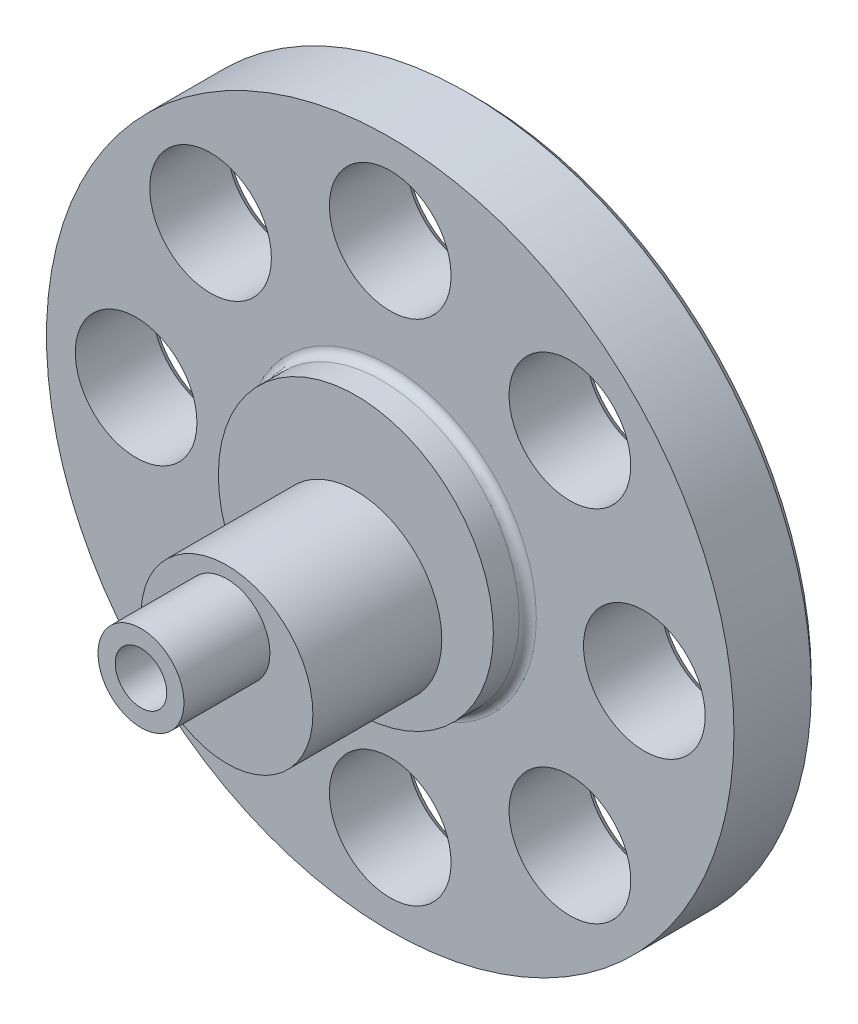
from build123d import *

# Parameters (mm, degrees)
SKETCH1_R           = 20
SKETCH1_R_2         = 3.54
BOSS_EXTRUDE1_DEPTH = 5
SKETCH2_R           = 8
BOSS_EXTRUDE2_DEPTH = 2
SKETCH3_R           = 6.5
CUT_EXTRUDE1_DEPTH  = 6
SKETCH4_R           = 5
BOSS_EXTRUDE3_DEPTH = 7.5
SKETCH5_R           = 2.5
BOSS_EXTRUDE4_DEPTH = 5
FILLET1_R           = 0.5
CHAMFER1_SIZE       = 0.5
SKETCH7_R           = 1.5
CUT_EXTRUDE2_DEPTH  = 15


with BuildPart() as part:
    # Sketch1 → Boss-Extrude1 (new body)
    with BuildSketch(Plane.XY):
        Circle(SKETCH1_R)
        with Locations((-14.783956386, 0)):
            Circle(SKETCH1_R_2, mode=Mode.SUBTRACT)
        with Locations((-10.453835814, -10.453835814)):
            Circle(SKETCH1_R_2, mode=Mode.SUBTRACT)
        with Locations((0, -14.783956386)):
            Circle(SKETCH1_R_2, mode=Mode.SUBTRACT)
        with Locations((10.453835814, -10.453835814)):
            Circle(SKETCH1_R_2, mode=Mode.SUBTRACT)
        with Locations((14.783956386, 0)):
            Circle(SKETCH1_R_2, mode=Mode.SUBTRACT)
        with Locations((10.453835814, 10.453835814)):
            Circle(SKETCH1_R_2, mode=Mode.SUBTRACT)
        with Locations((0, 14.783956386)):
            Circle(SKETCH1_R_2, mode=Mode.SUBTRACT)
        with Locations((-10.453835814, 10.453835814)):
            Circle(SKETCH1_R_2, mode=Mode.SUBTRACT)
    extrude(amount=BOSS_EXTRUDE1_DEPTH)

    # Sketch2 → Boss-Extrude2 (add)
    with BuildSketch(Plane.XY.offset(5)):
        Circle(SKETCH2_R)
    extrude(amount=BOSS_EXTRUDE2_DEPTH)

    # Sketch3 → Cut-Extrude1 (cut)
    with BuildSketch(Plane(origin=(0, 0, 0), x_dir=(-1, 0, 0), z_dir=(0, 0, -1))):
        Circle(SKETCH3_R)
    extrude(amount=-CUT_EXTRUDE1_DEPTH, mode=Mode.SUBTRACT)

    # Sketch4 → Boss-Extrude3 (add)
    with BuildSketch(Plane.XY.offset(7)):
        with Locations((0, -1.812)):
            Circle(SKETCH4_R)
    extrude(amount=BOSS_EXTRUDE3_DEPTH)

    # Sketch5 → Boss-Extrude4 (add)
    with BuildSketch(Plane.XY.offset(14.5)):
        Circle(SKETCH5_R)
    extrude(amount=BOSS_EXTRUDE4_DEPTH)

    # Fillet1
    fillet1_edges = [part.edges().sort_by_distance(p)[0] for p in [
        (-8, 0, 5),
    ]]
    fillet(fillet1_edges, radius=FILLET1_R)

    # Chamfer1
    chamfer1_edges = [part.edges().sort_by_distance(p)[0] for p in [
        (-3.54, -14.783956386, 0),
        (6.913835814, -10.453835814, 0),
        (-20, 0, 0),
        (11.243956386, 0, 0),
        (6.913835814, 10.453835814, 0),
        (-3.54, 14.783956386, 0),
        (-13.993835814, 10.453835814, 0),
        (6.5, 0, 0),
        (-18.323956386, 0, 0),
        (-13.993835814, -10.453835814, 0),
    ]]
    chamfer(chamfer1_edges, length=CHAMFER1_SIZE)

    # Sketch7 → Cut-Extrude2 (cut)
    with BuildSketch(Plane.XY.offset(19.5)):
        Circle(SKETCH7_R)
    extrude(amount=-CUT_EXTRUDE2_DEPTH, mode=Mode.SUBTRACT)


solid = part.part
